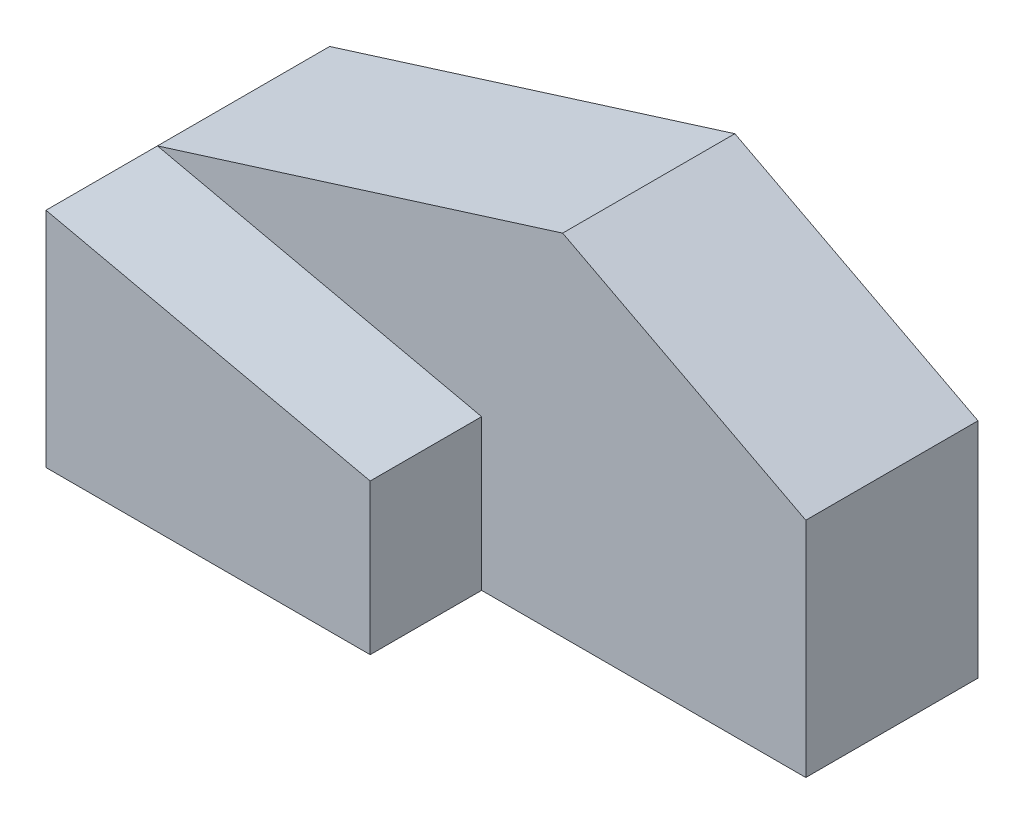
from build123d import *

# Parameters (mm, degrees)
SKETCH1_W           = 101.6
SKETCH1_H           = 34.925
BOSS_EXTRUDE2_DEPTH = 26.9875
BOSS_EXTRUDE3_DEPTH = 17.4625


with BuildPart() as part:
    # Sketch1 → Boss-Extrude2 (new body)
    with BuildSketch(Plane.XY):
        Polygon((12.7, 19.910607408), (50.8, 0), (-50.8, 0), align=None)
        with Locations((0, -17.4625)):
            Rectangle(SKETCH1_W, SKETCH1_H)
    extrude(amount=BOSS_EXTRUDE2_DEPTH)

    # Sketch3 → Boss-Extrude3 (add)
    with BuildSketch(Plane.XY.offset(26.9875)):
        Polygon((-50.8, 0), (0, -11.346798656), (0, -34.925), (-50.8, -34.925), align=None)
    extrude(amount=BOSS_EXTRUDE3_DEPTH)


solid = part.part
